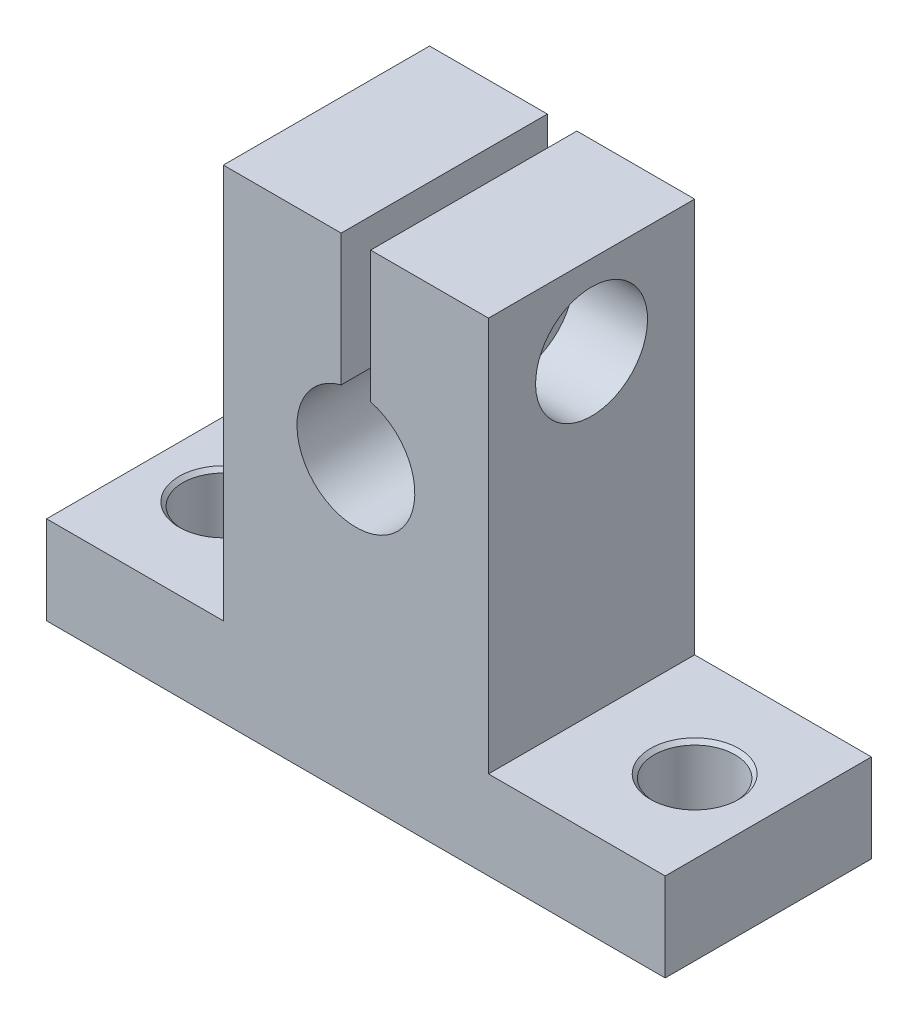
from build123d import *

# Parameters (mm, degrees)
EXTRUDE_1_DEPTH     = 7
SKETCH_2_R          = 2.75
CUT_EXTRUDE_1_DEPTH = 6
SKETCH_4_R          = 1.65
CUT_EXTRUDE_2_DEPTH = 8
SKETCH_5_R          = 2.1
CUT_EXTRUDE_3_DEPTH = 8
SKETCH_6_R          = 3.8
CUT_EXTRUDE_4_DEPTH = 5
CHAMFER_1_SIZE      = 0.25


with BuildPart() as part:
    # Эскиз1 → Бобышка-Вытянуть1 (new, symmetric)
    with BuildSketch(Plane.XY):
        with BuildLine():
            Line((-9, 16.4), (-1, 16.4))
            Line((-1, 16.4), (-1, 7.472983346))
            ThreePointArc((-1, 7.472983346), (0, -0.4), (1, 7.472983346))
            Line((1, 7.472983346), (1, 16.4))
            Line((1, 16.4), (9, 16.4))
            Line((9, 16.4), (9, -10.4))
            Line((9, -10.4), (21, -10.4))
            Line((21, -10.4), (21, -16.4))
            Line((21, -16.4), (-21, -16.4))
            Line((-21, -16.4), (-21, -10.4))
            Line((-21, -10.4), (-9, -10.4))
            Line((-9, -10.4), (-9, 16.4))
        make_face()
    extrude(amount=EXTRUDE_1_DEPTH, both=True)

    # Эскиз2 → Вырез-Вытянуть1 (cut)
    with BuildSketch(Plane(origin=(0, -10.4, 0), x_dir=(1, 0, 0), z_dir=(0, 1, 0))):
        with Locations(Location((-16, 0, 0), (0, 0, 180))):
            Circle(SKETCH_2_R)
        with Locations(Location((16, 0, 0), (0, 0, 180))):
            Circle(SKETCH_2_R)
    extrude(amount=-CUT_EXTRUDE_1_DEPTH, mode=Mode.SUBTRACT)

    # Эскиз4 → Вырез-Вытянуть2 (cut)
    with BuildSketch(Plane(origin=(-1, 0, 0), x_dir=(0, 0, -1), z_dir=(1, 0, 0))):
        with Locations((0, 10.936491673)):
            Circle(SKETCH_4_R)
    extrude(amount=-CUT_EXTRUDE_2_DEPTH, mode=Mode.SUBTRACT)

    # Эскиз5 → Вырез-Вытянуть3 (cut)
    with BuildSketch(Plane(origin=(9, 0, 0), x_dir=(0, 0, -1), z_dir=(1, 0, 0))):
        with Locations(Location((0, 10.936491673, 0), (0, 0, 90))):
            Circle(SKETCH_5_R)
    extrude(amount=-CUT_EXTRUDE_3_DEPTH, mode=Mode.SUBTRACT)

    # Эскиз6 → Вырез-Вытянуть4 (cut)
    with BuildSketch(Plane(origin=(9, 0, 0), x_dir=(0, 0, -1), z_dir=(1, 0, 0))):
        with Locations(Location((0, 10.936491673, 0), (0, 0, 90))):
            Circle(SKETCH_6_R)
    extrude(amount=-CUT_EXTRUDE_4_DEPTH, mode=Mode.SUBTRACT)

    # Фаска1
    chamfer_1_edges = [part.edges().sort_by_distance(p)[0] for p in [
        (-13.25, -10.4, 0),
        (18.75, -10.4, 0),
        (-9, 10.936491673, 1.65),
    ]]
    chamfer(chamfer_1_edges, length=CHAMFER_1_SIZE)


solid = part.part
